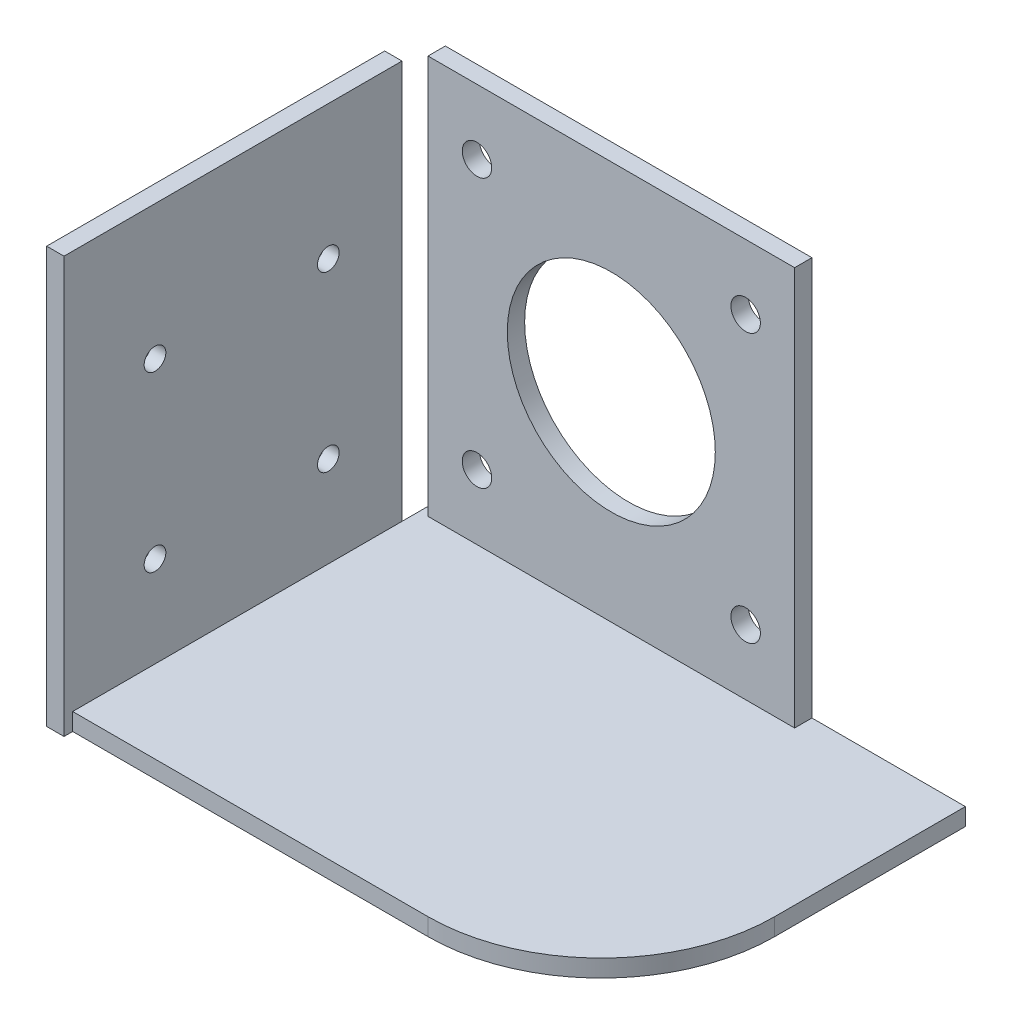
from build123d import *

# Parameters (mm, degrees)
SKETCH1_W                   = 42.3
SKETCH1_H                   = 46
SKETCH1_R                   = 12
SKETCH1_R_2                 = 1.7
BOSS_EXTRUDE1_DEPTH         = 2
BOSS_EXTRUDE4_DEPTH         = 2
BOSS_EXTRUDE6_REACH         = 76.681
SKETCH6_W                   = 2
SKETCH6_H                   = 39
M3_TAPPED_HOLE2_D           = 2.5
M3_TAPPED_HOLE2_CSINK_D     = 3.05
M3_TAPPED_HOLE2_CSINK_ANGLE = 90


with BuildPart() as part:
    # Sketch1 → Boss-Extrude1 (new body)
    with BuildSketch(Plane.XY):
        Rectangle(SKETCH1_W, SKETCH1_H)
        Circle(SKETCH1_R, mode=Mode.SUBTRACT)
        with Locations((-15.5, 15.5)):
            Circle(SKETCH1_R_2, mode=Mode.SUBTRACT)
        with Locations((15.5, 15.5)):
            Circle(SKETCH1_R_2, mode=Mode.SUBTRACT)
        with Locations((15.5, -15.5)):
            Circle(SKETCH1_R_2, mode=Mode.SUBTRACT)
        with Locations((-15.5, -15.5)):
            Circle(SKETCH1_R_2, mode=Mode.SUBTRACT)
    extrude(amount=BOSS_EXTRUDE1_DEPTH)

    # Sketch4 → Boss-Extrude4 (add)
    with BuildSketch(Plane.XZ.offset(23)):
        with BuildLine():
            Line((-21.15, 0), (38.85, 0))
            Line((38.85, 0), (38.85, 22))
            ThreePointArc((38.85, 22), (32.992135624, 36.142135624), (18.85, 42))
            Line((18.85, 42), (-21.15, 42))
            Line((-21.15, 42), (-22.15, 42))
            Line((-22.15, 42), (-22.15, 0))
            Line((-22.15, 0), (-21.15, 0))
        make_face()
    extrude(amount=BOSS_EXTRUDE4_DEPTH)

    # Boss-Extrude6: up to this face of the body (flat: up to its plane)
    boss_extrude6_end = Plane(part.part.faces().sort_by_distance((7.447529356, -25, 20.426864787))[0])
    # Sketch6 → Boss-Extrude6 (add, up to the picked face)
    with BuildSketch(Plane(origin=(0, 23, 0), x_dir=(1, 0, 0), z_dir=(0, 1, 0)), mode=Mode.PRIVATE) as boss_extrude6_sk1:
        with Locations((-23.15, -23.5)):
            Rectangle(SKETCH6_W, SKETCH6_H)
    boss_extrude6_tool1 = split(extrude(boss_extrude6_sk1.sketch, amount=-BOSS_EXTRUDE6_REACH, mode=Mode.PRIVATE), bisect_by=boss_extrude6_end, keep=Keep.BOTH, mode=Mode.PRIVATE)
    add(boss_extrude6_tool1.solids().sort_by(Axis((-23.15, 23, 23.5), (0, -1, 0)))[0])

    # M3 Tapped Hole2 (through all)
    with Locations(Plane(origin=(-24.15, 7.5, 12.5), x_dir=(0, 0, -1), z_dir=(-1, 0, 0))):
        with Locations((0, 0), (-20, 0), (-20, 20), (0, 20)):
            CounterSinkHole(M3_TAPPED_HOLE2_D / 2, M3_TAPPED_HOLE2_CSINK_D / 2, counter_sink_angle=M3_TAPPED_HOLE2_CSINK_ANGLE)


solid = part.part
